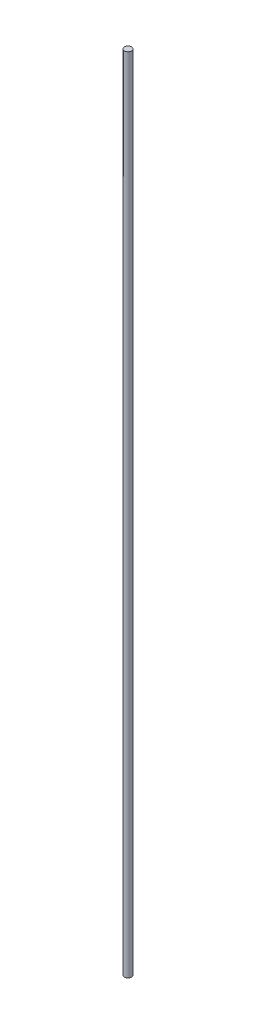
from build123d import *

# Parameters (mm, degrees)
SKETCH1_R           = 1.5
BOSS_EXTRUDE1_DEPTH = 340


with BuildPart() as part:
    # Sketch1 → Boss-Extrude1 (new body)
    with BuildSketch(Plane(origin=(0, 0, 0), x_dir=(1, 0, 0), z_dir=(0, 1, 0))):
        with Locations(Location((0, 0, 0), (0, 0, 270))):
            Circle(SKETCH1_R)
    extrude(amount=BOSS_EXTRUDE1_DEPTH)


solid = part.part
